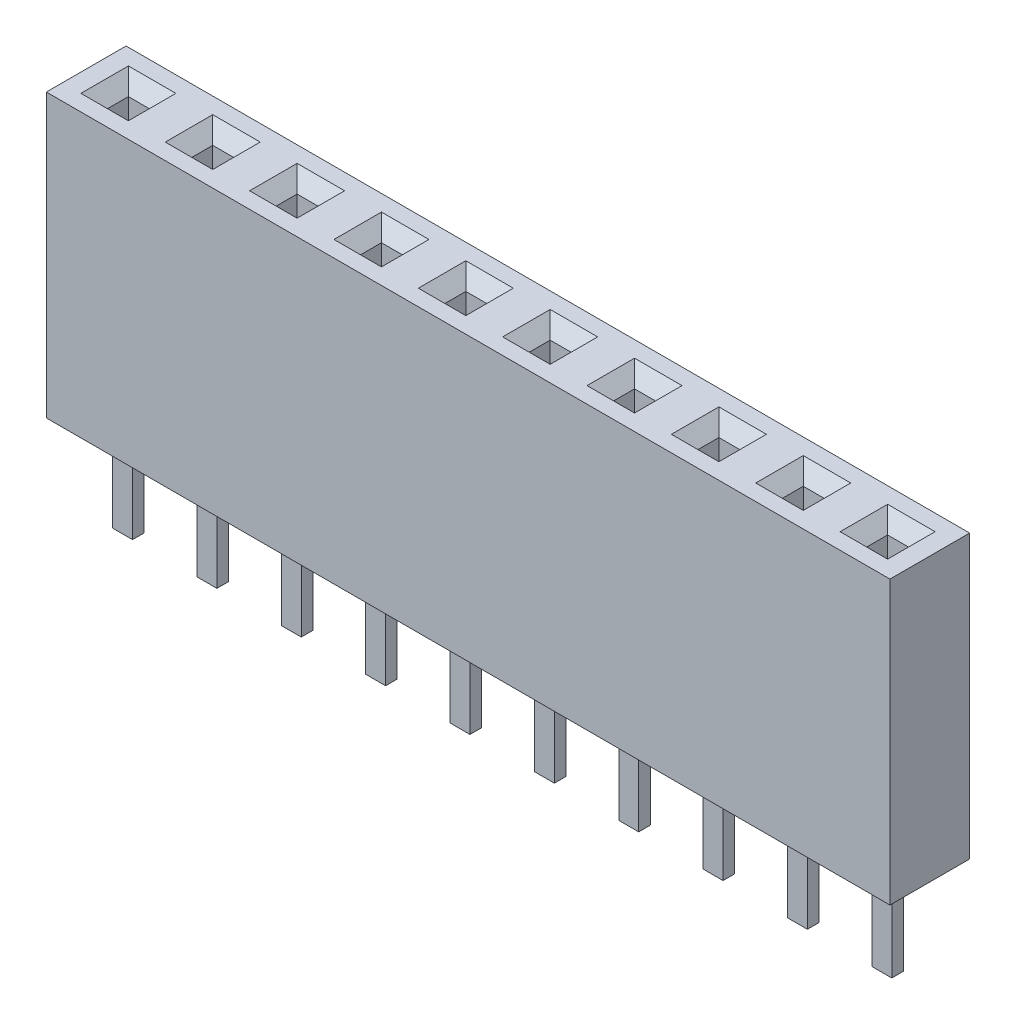
from build123d import *

# Parameters (mm, degrees)
SKETCH1_W           = 38.1
SKETCH1_H           = 2.4
BOSS_EXTRUDE1_DEPTH = 8.5
SKETCH2_W           = 0.63
SKETCH2_H           = 0.63
CUT_EXTRUDE1_DEPTH  = 6.5
SKETCH3_W           = 0.6
SKETCH3_H           = 0.35
BOSS_EXTRUDE2_DEPTH = 2.9
CHAMFER1_SIZE       = 0.4
SKETCH4_W           = 19.378829163
SKETCH4_H           = 4.471478983
CUT_EXTRUDE2_DEPTH  = 23.232914789


with BuildPart() as part:
    # Sketch1 → Boss-Extrude1 (new body)
    with BuildSketch(Plane(origin=(0, 0, 0), x_dir=(1, 0, 0), z_dir=(0, 1, 0))):
        Rectangle(SKETCH1_W, SKETCH1_H)
    extrude(amount=BOSS_EXTRUDE1_DEPTH)

    # Sketch2 → Cut-Extrude1 (cut)
    with BuildSketch(Plane(origin=(0, 8.5, 0), x_dir=(1, 0, 0), z_dir=(0, 1, 0))):
        with Locations((-15.24, 0)):
            Rectangle(SKETCH2_W, SKETCH2_H)
        with Locations((-17.78, 0)):
            Rectangle(SKETCH2_W, SKETCH2_H)
        with Locations((-12.7, 0)):
            Rectangle(SKETCH2_W, SKETCH2_H)
        with Locations((-10.16, 0)):
            Rectangle(SKETCH2_W, SKETCH2_H)
        with Locations((-7.62, 0)):
            Rectangle(SKETCH2_W, SKETCH2_H)
        with Locations((-5.08, 0)):
            Rectangle(SKETCH2_W, SKETCH2_H)
        with Locations((-2.54, 0)):
            Rectangle(SKETCH2_W, SKETCH2_H)
        Rectangle(SKETCH2_W, SKETCH2_H)
        with Locations((2.54, 0)):
            Rectangle(SKETCH2_W, SKETCH2_H)
        with Locations((5.08, 0)):
            Rectangle(SKETCH2_W, SKETCH2_H)
        with Locations((7.62, 0)):
            Rectangle(SKETCH2_W, SKETCH2_H)
        with Locations((10.16, 0)):
            Rectangle(SKETCH2_W, SKETCH2_H)
        with Locations((12.7, 0)):
            Rectangle(SKETCH2_W, SKETCH2_H)
        with Locations((15.24, 0)):
            Rectangle(SKETCH2_W, SKETCH2_H)
        with Locations((17.78, 0)):
            Rectangle(SKETCH2_W, SKETCH2_H)
    extrude(amount=-CUT_EXTRUDE1_DEPTH, mode=Mode.SUBTRACT)

    # Sketch3 → Boss-Extrude2 (add)
    with BuildSketch(Plane.XZ):
        with Locations((-15.24, 0)):
            Rectangle(SKETCH3_W, SKETCH3_H)
        with Locations((-17.78, 0)):
            Rectangle(SKETCH3_W, SKETCH3_H)
        with Locations((-12.7, 0)):
            Rectangle(SKETCH3_W, SKETCH3_H)
        with Locations((-10.16, 0)):
            Rectangle(SKETCH3_W, SKETCH3_H)
        with Locations((-7.62, 0)):
            Rectangle(SKETCH3_W, SKETCH3_H)
        with Locations((-5.08, 0)):
            Rectangle(SKETCH3_W, SKETCH3_H)
        with Locations((-2.54, 0)):
            Rectangle(SKETCH3_W, SKETCH3_H)
        Rectangle(SKETCH3_W, SKETCH3_H)
        with Locations((2.54, 0)):
            Rectangle(SKETCH3_W, SKETCH3_H)
        with Locations((5.08, 0)):
            Rectangle(SKETCH3_W, SKETCH3_H)
        with Locations((7.62, 0)):
            Rectangle(SKETCH3_W, SKETCH3_H)
        with Locations((10.16, 0)):
            Rectangle(SKETCH3_W, SKETCH3_H)
        with Locations((12.7, 0)):
            Rectangle(SKETCH3_W, SKETCH3_H)
        with Locations((15.24, 0)):
            Rectangle(SKETCH3_W, SKETCH3_H)
        with Locations((17.78, 0)):
            Rectangle(SKETCH3_W, SKETCH3_H)
    extrude(amount=BOSS_EXTRUDE2_DEPTH)

    # Chamfer1
    chamfer1_edges = [part.edges().sort_by_distance(p)[0] for p in [
        (2.855, 8.5, 0),
        (2.54, 8.5, -0.315),
        (2.225, 8.5, 0),
        (2.54, 8.5, 0.315),
        (5.395, 8.5, 0),
        (5.08, 8.5, -0.315),
        (4.765, 8.5, 0),
        (5.08, 8.5, 0.315),
        (7.935, 8.5, 0),
        (7.62, 8.5, -0.315),
        (7.305, 8.5, 0),
        (7.62, 8.5, 0.315),
        (10.475, 8.5, 0),
        (10.16, 8.5, -0.315),
        (9.845, 8.5, 0),
        (10.16, 8.5, 0.315),
        (13.015, 8.5, 0),
        (12.7, 8.5, -0.315),
        (12.385, 8.5, 0),
        (12.7, 8.5, 0.315),
        (15.555, 8.5, 0),
        (15.24, 8.5, -0.315),
        (14.925, 8.5, 0),
        (15.24, 8.5, 0.315),
        (18.095, 8.5, 0),
        (17.78, 8.5, -0.315),
        (17.465, 8.5, 0),
        (17.78, 8.5, 0.315),
        (-17.465, 8.5, 0),
        (-17.78, 8.5, -0.315),
        (-18.095, 8.5, 0),
        (-17.78, 8.5, 0.315),
        (-14.925, 8.5, 0),
        (-15.24, 8.5, -0.315),
        (-15.555, 8.5, 0),
        (-15.24, 8.5, 0.315),
        (-12.385, 8.5, 0),
        (-12.7, 8.5, -0.315),
        (-13.015, 8.5, 0),
        (-12.7, 8.5, 0.315),
        (-9.845, 8.5, 0),
        (-10.16, 8.5, -0.315),
        (-10.475, 8.5, 0),
        (-10.16, 8.5, 0.315),
        (-7.305, 8.5, 0),
        (-7.62, 8.5, -0.315),
        (-7.935, 8.5, 0),
        (-7.62, 8.5, 0.315),
        (-4.765, 8.5, 0),
        (-5.08, 8.5, -0.315),
        (-5.395, 8.5, 0),
        (-5.08, 8.5, 0.315),
        (-2.225, 8.5, 0),
        (-2.54, 8.5, -0.315),
        (-2.855, 8.5, 0),
        (-2.54, 8.5, 0.315),
        (0.315, 8.5, 0),
        (0, 8.5, -0.315),
        (-0.315, 8.5, 0),
        (0, 8.5, 0.315),
    ]]
    chamfer(chamfer1_edges, length=CHAMFER1_SIZE)

    # Sketch4 → Cut-Extrude2 (cut, through all)
    with BuildSketch(Plane(origin=(0, 8.5, 0), x_dir=(1, 0, 0), z_dir=(0, 1, 0))):
        with Locations((16.039414582, -0.096925096)):
            Rectangle(SKETCH4_W, SKETCH4_H)
    extrude(amount=-CUT_EXTRUDE2_DEPTH, mode=Mode.SUBTRACT)


solid = part.part
